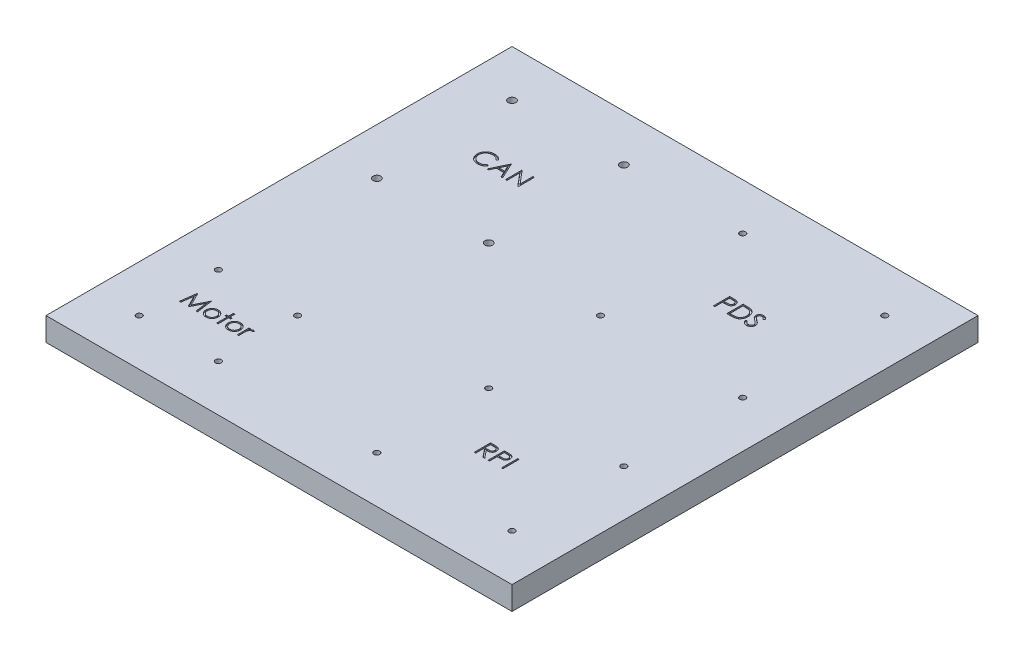
from build123d import *

# Parameters (mm, degrees)
SKETCH1_W           = 200
SKETCH1_H           = 200
BOSS_EXTRUDE2_DEPTH = 10
SKETCH1_4_R         = 1.25
SKETCH1_4_R_2       = 1.65
CUT_EXTRUDE1_DEPTH  = 284.019433962
SKETCH2_W           = 0.628205128
SKETCH2_H           = 7
CUT_EXTRUDE2_DEPTH  = 0.5


with BuildPart() as part:
    # Sketch1 → Boss-Extrude2 (new body)
    with BuildSketch(Plane(origin=(0, 0, 0), x_dir=(1, 0, 0), z_dir=(0, 1, 0))):
        with Locations((100, 100)):
            Rectangle(SKETCH1_W, SKETCH1_H)
    extrude(amount=BOSS_EXTRUDE2_DEPTH)

    # Sketch1<4> → Cut-Extrude1 (cut, through all)
    with BuildSketch(Plane(origin=(0, 0, 0), x_dir=(1, 0, 0), z_dir=(0, 1, 0))):
        with Locations((180, 180)):
            Circle(SKETCH1_4_R)
        with Locations((119, 180)):
            Circle(SKETCH1_4_R)
        with Locations((119, 119)):
            Circle(SKETCH1_4_R)
        with Locations((180, 119)):
            Circle(SKETCH1_4_R)
        with Locations((20, 180)):
            Circle(SKETCH1_4_R_2)
        with Locations((68, 180)):
            Circle(SKETCH1_4_R_2)
        with Locations((20, 122)):
            Circle(SKETCH1_4_R_2)
        with Locations((68, 122)):
            Circle(SKETCH1_4_R_2)
        with Locations((20, 20)):
            Circle(SKETCH1_4_R)
        with Locations((20, 54)):
            Circle(SKETCH1_4_R)
        with Locations((54, 54)):
            Circle(SKETCH1_4_R)
        with Locations((54, 20)):
            Circle(SKETCH1_4_R)
        with Locations((180, 68)):
            Circle(SKETCH1_4_R)
        with Locations((180, 20)):
            Circle(SKETCH1_4_R)
        with Locations((122, 68)):
            Circle(SKETCH1_4_R)
        with Locations((122, 20)):
            Circle(SKETCH1_4_R)
    extrude(amount=CUT_EXTRUDE1_DEPTH, mode=Mode.SUBTRACT)

    # Sketch2 → Cut-Extrude2 (cut)
    # profile 1 of 14: a face of its own
    with BuildSketch(Plane(origin=(0, 10, 0), x_dir=(1, 0, 0), z_dir=(0, 1, 0))):
        Polygon((23.329689197, 33.84313401), (24.253767723, 40.84313401), (24.343511313, 40.84313401), (27.233535351, 35.099544266), (30.115145928, 40.84313401), (30.204889518, 40.84313401), (31.137381505, 33.84313401), (30.509176377, 33.84313401), (29.836099454, 38.875786254), (27.310658749, 33.84313401), (27.167629902, 33.84313401), (24.630971249, 38.891210933), (23.962101056, 33.84313401), align=None)
    # profile 2 of 14: a face of its own
    with BuildSketch(Plane(origin=(0, 10, 0), x_dir=(1, 0, 0), z_dir=(0, 1, 0))):
        with BuildLine():
            add(Edge.make_bspline(
                [(34.864544967, 39.048262215), (34.960527512, 39.046218433), (35.148725827, 39.042211075), (35.424341599, 38.999381144), (35.687431871, 38.933886415), (35.939004255, 38.843343291), (36.175836846, 38.72197939), (36.401379334, 38.577160808), (36.615013352, 38.405595621), (36.743059411, 38.272879484), (36.808054582, 38.205513818)],
                knots=[0, 0, 0, 0, 1.054011418, 2.066658804, 3.057071809, 4.030435133, 4.997543892, 5.974964718, 6.972108034, 8, 8, 8, 8], degree=3))
            add(Edge.make_bspline(
                [(36.808054582, 38.205513818), (36.86401849, 38.141085846), (36.974863251, 38.013476762), (37.116994688, 37.806565536), (37.239437808, 37.592285335), (37.33756373, 37.367790681), (37.414933778, 37.135041339), (37.46986517, 36.893237317), (37.50253904, 36.642912622), (37.506944974, 36.472904946), (37.509176377, 36.386803882)],
                knots=[0, 0, 0, 0, 1.025258237, 2.030674902, 3.01204498, 3.988269485, 4.97094183, 5.956517959, 6.965070386, 8, 8, 8, 8], degree=3))
            add(Edge.make_bspline(
                [(37.509176377, 36.386803882), (37.507213702, 36.300203766), (37.503335366, 36.1290779), (37.466648133, 35.877039168), (37.409585961, 35.632649523), (37.327922285, 35.396932135), (37.223206066, 35.169166481), (37.095424691, 34.950347382), (36.943681457, 34.740043115), (36.771673463, 34.540039439), (36.581569711, 34.355707009), (36.375337414, 34.19505047), (36.157029347, 34.057407421), (35.92374264, 33.94653459), (35.677607667, 33.85911519), (35.41809353, 33.797715157), (35.14560339, 33.760591789), (34.959548947, 33.755824643), (34.864544967, 33.75339042)],
                knots=[0, 0, 0, 0, 0.998656419, 1.973391657, 2.932242238, 3.890759089, 4.846373663, 5.82037756, 6.809684879, 7.83454468, 8.860553229, 9.859544525, 10.845671541, 11.83227036, 12.833544569, 13.85385346, 14.904124723, 16, 16, 16, 16], degree=3))
            add(Edge.make_bspline(
                [(34.864544967, 33.75339042), (34.769075528, 33.755832813), (34.582093808, 33.760616362), (34.308641844, 33.797570927), (34.048662606, 33.859086892), (33.802205409, 33.946821878), (33.567915715, 34.057410965), (33.348342722, 34.194634344), (33.141942891, 34.355754655), (32.951798922, 34.540026529), (32.779801711, 34.740046442), (32.628055694, 34.950346519), (32.500275042, 35.169166705), (32.395558634, 35.396932075), (32.313895008, 35.632649539), (32.256832823, 35.877039164), (32.220145594, 36.129077901), (32.216267257, 36.300203767), (32.214304582, 36.386803882)],
                knots=[0, 0, 0, 0, 1.099876186, 2.154163076, 3.173186993, 4.173200201, 5.163417411, 6.152872554, 7.150605724, 8.17532212, 9.198891216, 10.186952605, 11.159729845, 12.11414092, 13.071450619, 14.029093627, 15.002601286, 16, 16, 16, 16], degree=3))
            add(Edge.make_bspline(
                [(32.214304582, 36.386803882), (32.216551203, 36.472436974), (32.220999126, 36.641975778), (32.253640144, 36.8918299), (32.308357257, 37.133224678), (32.38582005, 37.36507563), (32.484850431, 37.588586502), (32.605573007, 37.803396164), (32.749154272, 38.009371765), (32.859558175, 38.136815925), (32.915426377, 38.201307087)],
                knots=[0, 0, 0, 0, 1.031353054, 2.041901799, 3.029428768, 4.008703097, 4.981709435, 5.96992636, 6.972712378, 8, 8, 8, 8], degree=3))
            add(Edge.make_bspline(
                [(32.915426377, 38.201307087), (32.980323559, 38.269256965), (33.107955287, 38.402892358), (33.322652742, 38.573957406), (33.547640384, 38.721789554), (33.787090237, 38.840741985), (34.038455952, 38.93441902), (34.302894437, 38.99955005), (34.579445468, 39.04205676), (34.768564711, 39.046173116), (34.864544967, 39.048262215)],
                knots=[0, 0, 0, 0, 1.027980169, 2.021703884, 2.998553061, 3.971491411, 4.943284454, 5.930300938, 6.949603206, 8, 8, 8, 8], degree=3))
        make_face()
        with BuildLine():
            add(Edge.make_bspline(
                [(34.861740479, 38.420057087), (34.793865257, 38.418127904), (34.659866999, 38.414319338), (34.46262783, 38.385351529), (34.272747522, 38.339456521), (34.089865834, 38.274248408), (33.914599489, 38.190050611), (33.746780684, 38.08663389), (33.585915804, 37.965367977), (33.435151678, 37.826442634), (33.296787053, 37.674684645), (33.1758311, 37.512987927), (33.072980887, 37.343975235), (32.98730057, 37.167470812), (32.923486193, 36.981685984), (32.877140148, 36.788724722), (32.848199667, 36.588193889), (32.84442691, 36.451871852), (32.84250971, 36.382597151)],
                knots=[0, 0, 0, 0, 1.021534396, 2.016698045, 2.994645724, 3.958388632, 4.93408049, 5.916473867, 6.921342795, 7.962252576, 8.998418191, 10.008913653, 10.997312074, 11.973003931, 12.956656626, 13.948281152, 14.957379055, 16, 16, 16, 16], degree=3))
            add(Edge.make_bspline(
                [(32.84250971, 36.382597151), (32.845723357, 36.293093097), (32.852101846, 36.115444286), (32.903972319, 35.85382204), (32.990744879, 35.602658336), (33.107919438, 35.363425564), (33.254731876, 35.142081008), (33.427706009, 34.944738039), (33.62498541, 34.774366416), (33.84421841, 34.633004725), (34.080927046, 34.520685214), (34.331439688, 34.441087262), (34.592721076, 34.389343878), (34.771282539, 34.384200929), (34.861740479, 34.381595548)],
                knots=[0, 0, 0, 0, 1.016792936, 2.018143844, 3.017858371, 4.030088057, 5.03801393, 6.028138512, 7.003788237, 7.991172063, 8.984598303, 9.972568034, 10.972917682, 12, 12, 12, 12], degree=3))
            add(Edge.make_bspline(
                [(34.861740479, 34.381595548), (34.952193217, 34.384216109), (35.130744409, 34.389389023), (35.391662763, 34.440826662), (35.641490707, 34.521033984), (35.877953482, 34.632878403), (36.097086689, 34.774903233), (36.295784931, 34.943775987), (36.467282153, 35.14260369), (36.613949363, 35.363718747), (36.733042849, 35.602287452), (36.819409252, 35.853868396), (36.871404424, 36.11543248), (36.877766081, 36.293089141), (36.880971249, 36.382597151)],
                knots=[0, 0, 0, 0, 1.02726834, 2.027799167, 3.010890988, 4.004497153, 4.992059811, 5.971914811, 6.958719428, 7.966827853, 8.981595046, 9.981490638, 10.983022906, 12, 12, 12, 12], degree=3))
            add(Edge.make_bspline(
                [(36.880971249, 36.382597151), (36.879054709, 36.451872266), (36.87528325, 36.588195118), (36.846333322, 36.788720025), (36.800022242, 36.981703218), (36.736079008, 37.167407225), (36.65077098, 37.344432233), (36.545937394, 37.512491688), (36.425475343, 37.67524478), (36.285441101, 37.825952061), (36.134834346, 37.965422134), (35.973904269, 38.086680913), (35.806334312, 38.189596104), (35.631577147, 38.274968585), (35.448672011, 38.338863266), (35.259057753, 38.385616529), (35.062660133, 38.414196922), (34.929142047, 38.418091205), (34.861740479, 38.420057087)],
                knots=[0, 0, 0, 0, 1.042956736, 2.052379634, 3.044323526, 4.02829302, 5.004299113, 5.996692471, 7.007513377, 8.048758398, 9.090003419, 10.095195979, 11.07790575, 12.047570684, 13.018257071, 13.989683339, 14.985167495, 16, 16, 16, 16], degree=3))
        make_face(mode=Mode.SUBTRACT)
    # profile 3 of 14: a face of its own
    with BuildSketch(Plane(origin=(0, 10, 0), x_dir=(1, 0, 0), z_dir=(0, 1, 0))):
        Polygon((39.393791761, 41.022621189), (40.02199689, 41.022621189), (40.02199689, 38.958518625), (40.919432787, 38.958518625), (40.919432787, 38.330313497), (40.02199689, 38.330313497), (40.02199689, 33.84313401), (39.393791761, 33.84313401), (39.393791761, 38.330313497), (38.496355864, 38.330313497), (38.496355864, 38.958518625), (39.393791761, 38.958518625), align=None)
    # profile 4 of 14: a face of its own
    with BuildSketch(Plane(origin=(0, 10, 0), x_dir=(1, 0, 0), z_dir=(0, 1, 0))):
        with BuildLine():
            add(Edge.make_bspline(
                [(44.467109069, 39.048262215), (44.563091615, 39.046218433), (44.75128993, 39.042211075), (45.026905702, 38.999381144), (45.289995974, 38.933886415), (45.541568358, 38.843343291), (45.778400949, 38.72197939), (46.003943437, 38.577160808), (46.217577455, 38.405595621), (46.345623513, 38.272879484), (46.410618685, 38.205513818)],
                knots=[0, 0, 0, 0, 1.054011418, 2.066658804, 3.057071809, 4.030435133, 4.997543892, 5.974964718, 6.972108034, 8, 8, 8, 8], degree=3))
            add(Edge.make_bspline(
                [(46.410618685, 38.205513818), (46.466582593, 38.141085846), (46.577427353, 38.013476762), (46.719558791, 37.806565536), (46.842001911, 37.592285335), (46.940127833, 37.367790681), (47.01749788, 37.135041339), (47.072429273, 36.893237317), (47.105103143, 36.642912622), (47.109509077, 36.472904946), (47.111740479, 36.386803882)],
                knots=[0, 0, 0, 0, 1.025258237, 2.030674902, 3.01204498, 3.988269485, 4.97094183, 5.956517959, 6.965070386, 8, 8, 8, 8], degree=3))
            add(Edge.make_bspline(
                [(47.111740479, 36.386803882), (47.109777805, 36.300203766), (47.105899468, 36.1290779), (47.069212235, 35.877039168), (47.012150064, 35.632649523), (46.930486387, 35.396932135), (46.825770169, 35.169166481), (46.697988794, 34.950347382), (46.546245559, 34.740043115), (46.374237566, 34.540039439), (46.184133814, 34.355707009), (45.977901517, 34.19505047), (45.759593449, 34.057407421), (45.526306743, 33.94653459), (45.280171769, 33.85911519), (45.020657633, 33.797715157), (44.748167492, 33.760591789), (44.56211305, 33.755824643), (44.467109069, 33.75339042)],
                knots=[0, 0, 0, 0, 0.998656419, 1.973391657, 2.932242238, 3.890759089, 4.846373663, 5.82037756, 6.809684879, 7.83454468, 8.860553229, 9.859544525, 10.845671541, 11.83227036, 12.833544569, 13.85385346, 14.904124723, 16, 16, 16, 16], degree=3))
            add(Edge.make_bspline(
                [(44.467109069, 33.75339042), (44.37163963, 33.755832813), (44.184657911, 33.760616362), (43.911205947, 33.797570927), (43.651226709, 33.859086892), (43.404769512, 33.946821878), (43.170479818, 34.057410965), (42.950906824, 34.194634344), (42.744506993, 34.355754655), (42.554363024, 34.540026529), (42.382365814, 34.740046442), (42.230619797, 34.950346519), (42.102839145, 35.169166705), (41.998122737, 35.396932075), (41.916459111, 35.632649539), (41.859396926, 35.877039164), (41.822709697, 36.129077901), (41.818831359, 36.300203767), (41.816868685, 36.386803882)],
                knots=[0, 0, 0, 0, 1.099876186, 2.154163076, 3.173186993, 4.173200201, 5.163417411, 6.152872554, 7.150605724, 8.17532212, 9.198891216, 10.186952605, 11.159729845, 12.11414092, 13.071450619, 14.029093627, 15.002601286, 16, 16, 16, 16], degree=3))
            add(Edge.make_bspline(
                [(41.816868685, 36.386803882), (41.819115305, 36.472436974), (41.823563228, 36.641975778), (41.856204246, 36.8918299), (41.910921359, 37.133224678), (41.988384152, 37.36507563), (42.087414534, 37.588586502), (42.20813711, 37.803396164), (42.351718375, 38.009371765), (42.462122278, 38.136815925), (42.517990479, 38.201307087)],
                knots=[0, 0, 0, 0, 1.031353054, 2.041901799, 3.029428768, 4.008703097, 4.981709435, 5.96992636, 6.972712378, 8, 8, 8, 8], degree=3))
            add(Edge.make_bspline(
                [(42.517990479, 38.201307087), (42.582887661, 38.269256965), (42.710519389, 38.402892358), (42.925216845, 38.573957406), (43.150204487, 38.721789554), (43.389654339, 38.840741985), (43.641020055, 38.93441902), (43.90545854, 38.99955005), (44.182009571, 39.04205676), (44.371128813, 39.046173116), (44.467109069, 39.048262215)],
                knots=[0, 0, 0, 0, 1.027980169, 2.021703884, 2.998553061, 3.971491411, 4.943284454, 5.930300938, 6.949603206, 8, 8, 8, 8], degree=3))
        make_face()
        with BuildLine():
            add(Edge.make_bspline(
                [(44.464304582, 38.420057087), (44.396429359, 38.418127904), (44.262431102, 38.414319338), (44.065191933, 38.385351529), (43.875311625, 38.339456521), (43.692429936, 38.274248408), (43.517163592, 38.190050611), (43.349344787, 38.08663389), (43.188479907, 37.965367977), (43.03771578, 37.826442634), (42.899351156, 37.674684645), (42.778395203, 37.512987927), (42.67554499, 37.343975235), (42.589864672, 37.167470812), (42.526050296, 36.981685984), (42.479704251, 36.788724722), (42.45076377, 36.588193889), (42.446991013, 36.451871852), (42.445073813, 36.382597151)],
                knots=[0, 0, 0, 0, 1.021534396, 2.016698045, 2.994645724, 3.958388632, 4.93408049, 5.916473867, 6.921342795, 7.962252576, 8.998418191, 10.008913653, 10.997312074, 11.973003931, 12.956656626, 13.948281152, 14.957379055, 16, 16, 16, 16], degree=3))
            add(Edge.make_bspline(
                [(42.445073813, 36.382597151), (42.44828746, 36.293093097), (42.454665949, 36.115444286), (42.506536422, 35.85382204), (42.593308982, 35.602658336), (42.710483541, 35.363425564), (42.857295978, 35.142081008), (43.030270112, 34.944738039), (43.227549512, 34.774366416), (43.446782513, 34.633004725), (43.683491149, 34.520685214), (43.934003791, 34.441087262), (44.195285179, 34.389343878), (44.373846641, 34.384200929), (44.464304582, 34.381595548)],
                knots=[0, 0, 0, 0, 1.016792936, 2.018143844, 3.017858371, 4.030088057, 5.03801393, 6.028138512, 7.003788237, 7.991172063, 8.984598303, 9.972568034, 10.972917682, 12, 12, 12, 12], degree=3))
            add(Edge.make_bspline(
                [(44.464304582, 34.381595548), (44.55475732, 34.384216109), (44.733308512, 34.389389023), (44.994226865, 34.440826662), (45.244054809, 34.521033984), (45.480517584, 34.632878403), (45.699650791, 34.774903233), (45.898349034, 34.943775987), (46.069846256, 35.14260369), (46.216513466, 35.363718747), (46.335606951, 35.602287452), (46.421973355, 35.853868396), (46.473968527, 36.11543248), (46.480330184, 36.293089141), (46.483535351, 36.382597151)],
                knots=[0, 0, 0, 0, 1.02726834, 2.027799167, 3.010890988, 4.004497153, 4.992059811, 5.971914811, 6.958719428, 7.966827853, 8.981595046, 9.981490638, 10.983022906, 12, 12, 12, 12], degree=3))
            add(Edge.make_bspline(
                [(46.483535351, 36.382597151), (46.481618811, 36.451872266), (46.477847353, 36.588195118), (46.448897424, 36.788720025), (46.402586345, 36.981703218), (46.33864311, 37.167407225), (46.253335083, 37.344432233), (46.148501496, 37.512491688), (46.028039446, 37.67524478), (45.888005204, 37.825952061), (45.737398448, 37.965422134), (45.576468372, 38.086680913), (45.408898415, 38.189596104), (45.234141249, 38.274968585), (45.051236114, 38.338863266), (44.861621856, 38.385616529), (44.665224236, 38.414196922), (44.531706149, 38.418091205), (44.464304582, 38.420057087)],
                knots=[0, 0, 0, 0, 1.042956736, 2.052379634, 3.044323526, 4.02829302, 5.004299113, 5.996692471, 7.007513377, 8.048758398, 9.090003419, 10.095195979, 11.07790575, 12.047570684, 13.018257071, 13.989683339, 14.985167495, 16, 16, 16, 16], degree=3))
        make_face(mode=Mode.SUBTRACT)
    # profile 5 of 14: a face of its own
    with BuildSketch(Plane(origin=(0, 10, 0), x_dir=(1, 0, 0), z_dir=(0, 1, 0))):
        with BuildLine():
            Line((48.188663556, 38.958518625), (48.816868685, 38.958518625))
            Line((48.816868685, 38.958518625), (48.816868685, 38.205513818))
            add(Edge.make_bspline(
                [(48.816868685, 38.205513818), (48.863246202, 38.275625474), (48.951942844, 38.409713473), (49.099368703, 38.587052075), (49.250375365, 38.733882168), (49.40568574, 38.850889206), (49.56644194, 38.938515443), (49.729115843, 39.002701513), (49.896266783, 39.040656144), (50.008590631, 39.045723462), (50.064865479, 39.048262215)],
                knots=[0, 0, 0, 0, 1.2804753, 2.448899062, 3.506932113, 4.484331642, 5.4025378, 6.288909075, 7.142734305, 8, 8, 8, 8], degree=3))
            add(Edge.make_bspline(
                [(50.064865479, 39.048262215), (50.108518132, 39.045881162), (50.198336303, 39.04098199), (50.334301482, 39.006560341), (50.474388386, 38.951604296), (50.564673161, 38.899923851), (50.611740479, 38.872981766)],
                knots=[0, 0, 0, 0, 0.901110191, 1.854092781, 2.881294221, 4, 4, 4, 4], degree=3))
            Line((50.611740479, 38.872981766), (50.266788556, 38.328911254))
            add(Edge.make_bspline(
                [(50.266788556, 38.328911254), (50.236570514, 38.342391786), (50.179210885, 38.367980417), (50.095301752, 38.398264437), (50.017939079, 38.416096269), (49.968651962, 38.418797704), (49.945674774, 38.420057087)],
                knots=[0, 0, 0, 0, 1.180555205, 2.24091978, 3.179933427, 4, 4, 4, 4], degree=3))
            add(Edge.make_bspline(
                [(49.945674774, 38.420057087), (49.895263307, 38.416697012), (49.792438527, 38.409843434), (49.641469528, 38.355965818), (49.494975117, 38.268915338), (49.378631793, 38.172373114), (49.288547287, 38.079277519), (49.224266836, 37.997980714), (49.165301342, 37.906823451), (49.108960901, 37.807364084), (49.057628313, 37.697904391), (49.009718974, 37.579537965), (48.966401249, 37.452127707), (48.94170076, 37.363362667), (48.929048172, 37.317893625)],
                knots=[0, 0, 0, 0, 1.125678352, 2.296057538, 3.5422874, 4.923748041, 5.663163013, 6.437101912, 7.23742474, 8.08941207, 8.991984279, 9.93940061, 10.944477711, 12, 12, 12, 12], degree=3))
            add(Edge.make_bspline(
                [(48.929048172, 37.317893625), (48.919583385, 37.277339278), (48.898619602, 37.187514481), (48.878236526, 37.036817432), (48.85809749, 36.858770114), (48.843904253, 36.652876928), (48.830748169, 36.41965204), (48.823328005, 36.158740149), (48.817121723, 35.869873447), (48.81695559, 35.66792474), (48.816868685, 35.562284651)],
                knots=[0, 0, 0, 0, 0.566838948, 1.255505196, 2.06880316, 3.007127437, 4.065329342, 5.249902469, 6.561414163, 8, 8, 8, 8], degree=3))
            Line((48.816868685, 35.562284651), (48.816868685, 33.84313401))
            Line((48.816868685, 33.84313401), (48.188663556, 33.84313401))
            Line((48.188663556, 33.84313401), (48.188663556, 38.958518625))
        make_face()
    # profile 6 of 14: a face of its own
    with BuildSketch(Plane(origin=(0, 10, 0), x_dir=(1, 0, 0), z_dir=(0, 1, 0))):
        with BuildLine():
            Line((142.709193492, 48.1080235), (144.110034838, 48.1080235))
            add(Edge.make_bspline(
                [(144.110034838, 48.1080235), (144.203517095, 48.107712328), (144.383013384, 48.107114843), (144.640159924, 48.103783317), (144.873814118, 48.094234606), (145.083853797, 48.086017439), (145.270275107, 48.071033556), (145.433649688, 48.056712262), (145.573225083, 48.03796494), (145.657716786, 48.020554094), (145.695972338, 48.012670935)],
                knots=[0, 0, 0, 0, 1.410062039, 2.707475311, 3.878576406, 4.937260626, 5.877586885, 6.699081471, 7.410979367, 8, 8, 8, 8], degree=3))
            add(Edge.make_bspline(
                [(145.695972338, 48.012670935), (145.747185586, 48.000017405), (145.848519565, 47.974980277), (145.994419697, 47.922061076), (146.133448345, 47.860821827), (146.265027994, 47.788894386), (146.388499576, 47.705744827), (146.505136198, 47.612808582), (146.615467124, 47.51059417), (146.715030385, 47.396524487), (146.808908488, 47.276851468), (146.888085741, 47.147443954), (146.956338701, 47.012120899), (147.010679735, 46.869506064), (147.054435681, 46.72098252), (147.08528816, 46.565204926), (147.103790535, 46.402882976), (147.105674247, 46.292167159), (147.106629389, 46.236028307)],
                knots=[0, 0, 0, 0, 1.027469482, 2.033020251, 3.019912614, 3.986113645, 4.951240523, 5.91722682, 6.890402269, 7.87763091, 8.8651537, 9.85103654, 10.82876324, 11.815024772, 12.821070561, 13.842952187, 14.906261191, 16, 16, 16, 16], degree=3))
            add(Edge.make_bspline(
                [(147.106629389, 46.236028307), (147.103691393, 46.142758098), (147.097958601, 45.960763762), (147.044508394, 45.696641999), (146.956955354, 45.45026337), (146.836308776, 45.221938094), (146.682669825, 45.016116804), (146.498020243, 44.835335893), (146.28225702, 44.684056068), (146.081398388, 44.579150458), (145.903969989, 44.511964641), (145.757903363, 44.464691923), (145.598569408, 44.428167993), (145.427494739, 44.395447729), (145.243967428, 44.370744341), (145.048427349, 44.352651152), (144.840735046, 44.341343054), (144.698056907, 44.339659044), (144.624658235, 44.33879273)],
                knots=[0, 0, 0, 0, 1.260483769, 2.459530307, 3.627416485, 4.787058657, 5.939039949, 7.08810263, 8.267026773, 9.491475466, 10.141966685, 10.831826277, 11.566392101, 12.351337768, 13.187381173, 14.07005841, 15.007169909, 16, 16, 16, 16], degree=3))
            Line((144.624658235, 44.33879273), (147.196372979, 41.1080235))
            Line((147.196372979, 41.1080235), (146.41953003, 41.1080235))
            Line((146.41953003, 41.1080235), (143.847815286, 44.33879273))
            Line((143.847815286, 44.33879273), (143.33739862, 44.33879273))
            Line((143.33739862, 44.33879273), (143.33739862, 41.1080235))
            Line((143.33739862, 41.1080235), (142.709193492, 41.1080235))
            Line((142.709193492, 41.1080235), (142.709193492, 48.1080235))
        make_face()
        with BuildLine():
            Line((143.33739862, 47.390074782), (143.33739862, 45.056741448))
            Line((143.33739862, 45.056741448), (144.619049261, 45.046925743))
            add(Edge.make_bspline(
                [(144.619049261, 45.046925743), (144.678889339, 45.04689927), (144.794876453, 45.046847957), (144.962677783, 45.05483551), (145.118918006, 45.063922146), (145.26299951, 45.077820837), (145.394986661, 45.095732981), (145.514813487, 45.118138949), (145.622675591, 45.144243074), (145.748472668, 45.184646326), (145.888945731, 45.248658362), (146.04160865, 45.34178936), (146.171613326, 45.458927598), (146.281449051, 45.59287451), (146.369707913, 45.740147008), (146.431932022, 45.898979746), (146.471416907, 46.065362942), (146.476073998, 46.179719158), (146.478424261, 46.237430551)],
                knots=[0, 0, 0, 0, 1.146690395, 2.22261258, 3.21895312, 4.145990853, 4.996080663, 5.770904154, 6.481378293, 7.121626537, 8.300444488, 9.431385265, 10.535395872, 11.636531494, 12.74115979, 13.810798291, 14.895190096, 16, 16, 16, 16], degree=3))
            add(Edge.make_bspline(
                [(146.478424261, 46.237430551), (146.476020019, 46.293723698), (146.471255688, 46.405276176), (146.432358151, 46.568587996), (146.366579388, 46.722721896), (146.277934912, 46.867050866), (146.169936602, 46.998062338), (146.043300977, 47.110156644), (145.901490587, 47.202655574), (145.76894819, 47.261764335), (145.650479765, 47.298004041), (145.547620445, 47.323506369), (145.431397489, 47.343995307), (145.301246572, 47.360411428), (145.157723311, 47.374521317), (145.000102009, 47.384024874), (144.829428448, 47.389652602), (144.711134586, 47.38993078), (144.64989862, 47.390074782)],
                knots=[0, 0, 0, 0, 1.101028733, 2.181837193, 3.264309656, 4.369019818, 5.486613113, 6.575447106, 7.666700264, 8.788928104, 9.402425223, 10.0903467, 10.862060571, 11.710948788, 12.657782767, 13.684531032, 14.801375019, 16, 16, 16, 16], degree=3))
            Line((144.64989862, 47.390074782), (143.33739862, 47.390074782))
        make_face(mode=Mode.SUBTRACT)
    # profile 7 of 14: a face of its own
    with BuildSketch(Plane(origin=(0, 10, 0), x_dir=(1, 0, 0), z_dir=(0, 1, 0))):
        with BuildLine():
            Line((148.632270415, 48.1080235), (150.005066889, 48.1080235))
            add(Edge.make_bspline(
                [(150.005066889, 48.1080235), (150.099488701, 48.107919707), (150.280405087, 48.107720836), (150.539835198, 48.101691344), (150.775454662, 48.09363796), (150.986755423, 48.082474174), (151.17438762, 48.069280993), (151.337502219, 48.050776915), (151.477381331, 48.031456323), (151.56119423, 48.01181351), (151.599417851, 48.00285523)],
                knots=[0, 0, 0, 0, 1.415646017, 2.712440637, 3.8905458, 4.950247383, 5.884950622, 6.709939814, 7.411656543, 8, 8, 8, 8], degree=3))
            add(Edge.make_bspline(
                [(151.599417851, 48.00285523), (151.647804918, 47.989611331), (151.743438873, 47.963435607), (151.881240959, 47.91100816), (152.01234865, 47.84884383), (152.137211767, 47.77799595), (152.254295933, 47.695424822), (152.365348015, 47.604477586), (152.469387975, 47.503054449), (152.565830759, 47.39229297), (152.654400354, 47.27405255), (152.73065972, 47.14656809), (152.794514174, 47.011985483), (152.849280717, 46.870398341), (152.888697626, 46.720617694), (152.918391425, 46.563684269), (152.93723868, 46.399614889), (152.939043804, 46.287495154), (152.939962722, 46.230419333)],
                knots=[0, 0, 0, 0, 0.999701418, 1.975846123, 2.934577507, 3.890451536, 4.834027766, 5.787354733, 6.749476667, 7.726910423, 8.712836071, 9.690891519, 10.682875813, 11.679750201, 12.712814741, 13.765529915, 14.8625177, 16, 16, 16, 16], degree=3))
            add(Edge.make_bspline(
                [(152.939962722, 46.230419333), (152.939119873, 46.172863779), (152.937470781, 46.060252451), (152.91767821, 45.895506875), (152.891017827, 45.738070095), (152.850023722, 45.588291194), (152.796332376, 45.447059653), (152.733348271, 45.312217189), (152.65738121, 45.186057845), (152.57009155, 45.06812361), (152.472988362, 44.958303785), (152.366482485, 44.857394196), (152.2510039, 44.76598552), (152.126919604, 44.683872832), (151.993019906, 44.612960273), (151.851335599, 44.549445663), (151.700635167, 44.496103542), (151.596350139, 44.468043419), (151.543328107, 44.453776705)],
                knots=[0, 0, 0, 0, 1.121902311, 2.195077645, 3.232258892, 4.234102512, 5.217864754, 6.176164875, 7.132989551, 8.084763148, 9.034132444, 9.988522005, 10.94243251, 11.903244335, 12.886203696, 13.894208494, 14.929344452, 16, 16, 16, 16], degree=3))
            add(Edge.make_bspline(
                [(151.543328107, 44.453776705), (151.499473439, 44.444450743), (151.403363384, 44.424012354), (151.24507794, 44.401195441), (151.060787168, 44.381720239), (150.850742608, 44.367117964), (150.615132798, 44.354617227), (150.353830284, 44.344681039), (150.066322129, 44.339221332), (149.865779641, 44.338939746), (149.761076504, 44.33879273)],
                knots=[0, 0, 0, 0, 0.601384939, 1.31797006, 2.144135048, 3.087295005, 4.142315834, 5.309527816, 6.595305764, 8, 8, 8, 8], degree=3))
            Line((149.761076504, 44.33879273), (149.260475543, 44.33879273))
            Line((149.260475543, 44.33879273), (149.260475543, 41.1080235))
            Line((149.260475543, 41.1080235), (148.632270415, 41.1080235))
            Line((148.632270415, 41.1080235), (148.632270415, 48.1080235))
        make_face()
        with BuildLine():
            Line((149.260475543, 47.390074782), (149.260475543, 45.056741448))
            Line((149.260475543, 45.056741448), (150.48603644, 45.041316769))
            add(Edge.make_bspline(
                [(150.48603644, 45.041316769), (150.545876292, 45.041285842), (150.661395892, 45.041226137), (150.828268338, 45.049196584), (150.983086913, 45.05839765), (151.125376064, 45.071869497), (151.255199933, 45.090912011), (151.37277499, 45.110135487), (151.477189556, 45.137946213), (151.59938796, 45.175392351), (151.735554655, 45.239257582), (151.883689752, 45.331957362), (152.009230924, 45.450118779), (152.117867518, 45.582974441), (152.204079274, 45.7307727), (152.267191258, 45.888910574), (152.304273573, 46.055766273), (152.30924596, 46.16994255), (152.311757594, 46.227614846)],
                knots=[0, 0, 0, 0, 1.160613943, 2.240541288, 3.23993089, 4.169200891, 5.011653406, 5.7853311, 6.478053781, 7.106038997, 8.262395093, 9.384106736, 10.481365981, 11.59014053, 12.70357646, 13.786202915, 14.881775077, 16, 16, 16, 16], degree=3))
            add(Edge.make_bspline(
                [(152.311757594, 46.227614846), (152.309232301, 46.283891873), (152.304212331, 46.395763637), (152.266900605, 46.559721158), (152.204201977, 46.716192567), (152.117288788, 46.862138738), (152.011806528, 46.994516346), (151.889207842, 47.1095106), (151.749781319, 47.201954005), (151.620084857, 47.261620568), (151.504882485, 47.298051119), (151.404818565, 47.3235408), (151.291837216, 47.343892013), (151.165901657, 47.360371018), (151.02798799, 47.374477941), (150.87691136, 47.384049895), (150.713244073, 47.389652808), (150.599622932, 47.389930718), (150.54072394, 47.390074782)],
                knots=[0, 0, 0, 0, 1.120700087, 2.227813068, 3.331159281, 4.466773991, 5.599788987, 6.693661531, 7.80175334, 8.91857717, 9.525282508, 10.207424825, 10.974604443, 11.810962634, 12.737642355, 13.736264703, 14.826523623, 16, 16, 16, 16], degree=3))
            Line((150.54072394, 47.390074782), (149.260475543, 47.390074782))
        make_face(mode=Mode.SUBTRACT)
    # profile 8 of 14: a face of its own
    with BuildSketch(Plane(origin=(0, 10, 0), x_dir=(1, 0, 0), z_dir=(0, 1, 0))):
        with Locations((154.689962722, 44.6080235)):
            Rectangle(SKETCH2_W, SKETCH2_H)
    # profile 9 of 14: a face of its own
    with BuildSketch(Plane(origin=(0, 10, 0), x_dir=(1, 0, 0), z_dir=(0, 1, 0))):
        with BuildLine():
            Line((39.269956909, 154.869478014), (38.720277422, 154.448804937))
            add(Edge.make_bspline(
                [(38.720277422, 154.448804937), (38.681065645, 154.495536877), (38.603170751, 154.588370708), (38.477852346, 154.718729797), (38.347249061, 154.84086032), (38.211410818, 154.955344079), (38.067892579, 155.058177611), (37.920170982, 155.154719816), (37.765774891, 155.241255292), (37.552271422, 155.346181265), (37.272975726, 155.455673575), (36.921386047, 155.547480037), (36.55436385, 155.605922389), (36.303968651, 155.612252072), (36.17660755, 155.615471604)],
                knots=[0, 0, 0, 0, 0.757959112, 1.505699292, 2.245454638, 2.979532153, 3.711538275, 4.438200793, 5.171680507, 5.909471876, 7.393775596, 8.890124382, 10.418191784, 12, 12, 12, 12], degree=3))
            add(Edge.make_bspline(
                [(36.17660755, 155.615471604), (36.106440951, 155.614663679), (35.966758966, 155.613055327), (35.759462019, 155.591837076), (35.556035917, 155.562014656), (35.356612984, 155.51776401), (35.161447067, 155.461818772), (34.969262263, 155.394967944), (34.782841064, 155.312258264), (34.599604587, 155.220841744), (34.424046165, 155.117586855), (34.25793607, 155.004960151), (34.101880134, 154.884221958), (33.95575491, 154.754919745), (33.819411013, 154.617635824), (33.693836391, 154.470907141), (33.579465571, 154.315202794), (33.474031521, 154.152575979), (33.379606054, 153.983500396), (33.300546295, 153.807350255), (33.230536051, 153.627142049), (33.175137565, 153.440839727), (33.131288532, 153.249754196), (33.101033205, 153.05337262), (33.080056263, 152.85210526), (33.078455909, 152.715686635), (33.077649217, 152.646921924)],
                knots=[0, 0, 0, 0, 1.054917814, 2.100044995, 3.131103042, 4.146048494, 5.169673617, 6.183595914, 7.203665975, 8.234915748, 9.262203917, 10.264457458, 11.251630812, 12.227803204, 13.197192746, 14.159520551, 15.12972552, 16.100847026, 17.073214652, 18.039054194, 19.002613845, 19.979014051, 20.95965708, 21.949030935, 22.966165397, 24, 24, 24, 24], degree=3))
            add(Edge.make_bspline(
                [(33.077649217, 152.646921924), (33.080172855, 152.543459284), (33.085127683, 152.340324115), (33.129224351, 152.042782894), (33.196234534, 151.757741546), (33.296665688, 151.486981861), (33.420503789, 151.227165145), (33.576985012, 150.982687438), (33.758218087, 150.749854309), (33.966766926, 150.534168414), (34.195578558, 150.337140963), (34.441074381, 150.1636398), (34.702642956, 150.019010035), (34.977396217, 149.898658142), (35.267448445, 149.806144687), (35.572278049, 149.74101644), (35.89122204, 149.698532079), (36.10916084, 149.694464703), (36.220077101, 149.692394681)],
                knots=[0, 0, 0, 0, 1.029171465, 2.020641659, 2.987623507, 3.938342917, 4.889210282, 5.84687017, 6.821220943, 7.821438502, 8.827599549, 9.822697543, 10.807740252, 11.797342354, 12.80366471, 13.83203677, 14.896651826, 16, 16, 16, 16], degree=3))
            add(Edge.make_bspline(
                [(36.220077101, 149.692394681), (36.342282479, 149.69577224), (36.582811897, 149.702420085), (36.93554795, 149.758738583), (37.273219481, 149.850054419), (37.595844654, 149.977850264), (37.902513947, 150.14398084), (38.193707267, 150.345376594), (38.469670408, 150.58395326), (38.635612973, 150.766119516), (38.720277422, 150.859061347)],
                knots=[0, 0, 0, 0, 1.028121516, 2.023589091, 2.998037872, 3.967518031, 4.937445131, 5.927275754, 6.942489185, 8, 8, 8, 8], degree=3))
            Line((38.720277422, 150.859061347), (39.269956909, 150.442595001))
            add(Edge.make_bspline(
                [(39.269956909, 150.442595001), (39.225720689, 150.385518097), (39.137460139, 150.271637685), (38.994544105, 150.111094265), (38.84398951, 149.960086194), (38.68467809, 149.819830952), (38.518442507, 149.687522021), (38.342297882, 149.566918358), (38.158559817, 149.456336589), (37.967850859, 149.35508274), (37.770373634, 149.265248246), (37.566364764, 149.188340711), (37.356703613, 149.122090932), (37.141380596, 149.067587058), (36.919949082, 149.025044891), (36.693208134, 148.996605541), (36.460668384, 148.977121712), (36.303785541, 148.97534588), (36.224283832, 148.974445963)],
                knots=[0, 0, 0, 0, 0.986787822, 1.968848986, 2.935600012, 3.899624008, 4.868462664, 5.837806735, 6.815139263, 7.798259679, 8.787526145, 9.778297419, 10.776456485, 11.791383307, 12.812564526, 13.85620153, 14.913611965, 16, 16, 16, 16], degree=3))
            add(Edge.make_bspline(
                [(36.224283832, 148.974445963), (36.148996498, 148.974969948), (36.000125118, 148.976006063), (35.780327615, 148.992790398), (35.566348453, 149.015689872), (35.358799201, 149.050170134), (35.156547251, 149.090858814), (34.961426082, 149.145401328), (34.771515661, 149.206499661), (34.58757898, 149.278309634), (34.40945958, 149.359341999), (34.237731958, 149.450925117), (34.072475093, 149.552288846), (33.912064251, 149.661198867), (33.758869084, 149.781153471), (33.611562033, 149.91048674), (33.469317081, 150.048762762), (33.381311711, 150.148472468), (33.337064281, 150.198604616)],
                knots=[0, 0, 0, 0, 1.114604814, 2.203992996, 3.262667896, 4.300477797, 5.318619304, 6.316056647, 7.298880507, 8.271930387, 9.238335007, 10.195173496, 11.151986948, 12.108099108, 13.064862484, 14.031167946, 15.010108607, 16, 16, 16, 16], degree=3))
            add(Edge.make_bspline(
                [(33.337064281, 150.198604616), (33.266192994, 150.285686994), (33.12530604, 150.458800415), (32.945054673, 150.739372378), (32.790759563, 151.032308795), (32.666007721, 151.339148653), (32.568482255, 151.659203427), (32.500919865, 151.992634456), (32.457016656, 152.339130341), (32.451996078, 152.574803918), (32.449444088, 152.694598206)],
                knots=[0, 0, 0, 0, 0.994628077, 1.977248131, 2.950237994, 3.925870899, 4.908910175, 5.911660606, 6.938484602, 8, 8, 8, 8], degree=3))
            add(Edge.make_bspline(
                [(32.449444088, 152.694598206), (32.452554476, 152.820509113), (32.458673968, 153.068230962), (32.510665559, 153.431778869), (32.594303151, 153.780081667), (32.713096929, 154.112489156), (32.863707631, 154.430749716), (33.049760859, 154.732432126), (33.269095143, 155.019465725), (33.519990279, 155.287495228), (33.795124949, 155.532573933), (34.089762577, 155.748186341), (34.403326471, 155.927621373), (34.732362174, 156.077613698), (35.079333537, 156.192902624), (35.443500276, 156.273608997), (35.824178105, 156.32384323), (36.083902957, 156.330193646), (36.215870371, 156.333420322)],
                knots=[0, 0, 0, 0, 1.032925535, 2.032216505, 3.007276963, 3.968222605, 4.92396291, 5.891752235, 6.871517503, 7.883894988, 8.900124299, 9.891468569, 10.874487609, 11.85992873, 12.854644235, 13.869047385, 14.917252991, 16, 16, 16, 16], degree=3))
            add(Edge.make_bspline(
                [(36.215870371, 156.333420322), (36.296299314, 156.332456045), (36.455500309, 156.330547357), (36.691005614, 156.311935073), (36.920290268, 156.280907861), (37.143512232, 156.238675721), (37.361757464, 156.186261078), (37.573357946, 156.117980481), (37.77955532, 156.039907419), (37.979049136, 155.949990487), (38.170882236, 155.849057004), (38.354994873, 155.738225757), (38.529924591, 155.617634146), (38.696902288, 155.488307795), (38.85313471, 155.347510677), (39.003057667, 155.199115485), (39.141579823, 155.038847836), (39.227086213, 154.926037968), (39.269956909, 154.869478014)],
                knots=[0, 0, 0, 0, 1.096760587, 2.17092713, 3.219439832, 4.250915756, 5.268269357, 6.278326846, 7.281116186, 8.274029601, 9.260640565, 10.235837813, 11.203064059, 12.156899882, 13.114053108, 14.069676657, 15.032185724, 16, 16, 16, 16], degree=3))
        make_face()
    # profile 10 of 14: a face of its own
    with BuildSketch(Plane(origin=(0, 10, 0), x_dir=(1, 0, 0), z_dir=(0, 1, 0))):
        Polygon((43.577649217, 156.153933142), (46.808418447, 149.153933142), (46.125525819, 149.153933142), (45.09067005, 151.397522886), (41.917392806, 151.397522886), (40.854492165, 149.153933142), (40.167392806, 149.153933142), (43.487905627, 156.153933142), align=None)
        Polygon((43.525766204, 154.788147886), (42.259540242, 152.115471604), (44.759740563, 152.115471604), align=None, mode=Mode.SUBTRACT)
    # profile 11 of 14: a face of its own
    with BuildSketch(Plane(origin=(0, 10, 0), x_dir=(1, 0, 0), z_dir=(0, 1, 0))):
        Polygon((48.064828704, 149.153933142), (48.064828704, 156.153933142), (48.196639601, 156.153933142), (52.82123896, 150.644518078), (52.82123896, 156.153933142), (53.449444088, 156.153933142), (53.449444088, 149.153933142), (53.306415242, 149.153933142), (48.693033832, 154.650728014), (48.693033832, 149.153933142), align=None)
    # profile 12 of 14: a face of its own
    with BuildSketch(Plane(origin=(0, 10, 0), x_dir=(1, 0, 0), z_dir=(0, 1, 0))):
        with BuildLine():
            Line((139.617751156, 153.83535139), (140.99054763, 153.83535139))
            add(Edge.make_bspline(
                [(140.99054763, 153.83535139), (141.084969442, 153.835247598), (141.265885828, 153.835048727), (141.525315939, 153.829019235), (141.760935403, 153.820965851), (141.972236164, 153.809802064), (142.159868361, 153.796608884), (142.32298296, 153.778104805), (142.462862072, 153.758784214), (142.546674971, 153.739141401), (142.584898591, 153.730183121)],
                knots=[0, 0, 0, 0, 1.415646017, 2.712440637, 3.8905458, 4.950247383, 5.884950622, 6.709939814, 7.411656543, 8, 8, 8, 8], degree=3))
            add(Edge.make_bspline(
                [(142.584898591, 153.730183121), (142.633285659, 153.716939221), (142.728919613, 153.690763498), (142.8667217, 153.638336051), (142.997829391, 153.576171721), (143.122692508, 153.505323841), (143.239776674, 153.422752712), (143.350828756, 153.331805477), (143.454868716, 153.23038234), (143.5513115, 153.11962086), (143.639881095, 153.00138044), (143.716140461, 152.873895981), (143.779994915, 152.739313374), (143.834761458, 152.597726231), (143.874178367, 152.447945584), (143.903872166, 152.29101216), (143.922719421, 152.126942779), (143.924524545, 152.014823044), (143.925443463, 151.957747223)],
                knots=[0, 0, 0, 0, 0.999701418, 1.975846123, 2.934577507, 3.890451536, 4.834027766, 5.787354733, 6.749476667, 7.726910423, 8.712836071, 9.690891519, 10.682875813, 11.679750201, 12.712814741, 13.765529915, 14.8625177, 16, 16, 16, 16], degree=3))
            add(Edge.make_bspline(
                [(143.925443463, 151.957747223), (143.924600614, 151.90019167), (143.922951522, 151.787580342), (143.903158951, 151.622834766), (143.876498568, 151.465397985), (143.835504463, 151.315619084), (143.781813117, 151.174387543), (143.718829012, 151.039545079), (143.642861951, 150.913385736), (143.555572291, 150.795451501), (143.458469103, 150.685631676), (143.351963226, 150.584722087), (143.236484641, 150.49331341), (143.112400345, 150.411200723), (142.978500647, 150.340288164), (142.83681634, 150.276773554), (142.686115907, 150.223431433), (142.58183088, 150.19537131), (142.528808848, 150.181104595)],
                knots=[0, 0, 0, 0, 1.121902311, 2.195077645, 3.232258892, 4.234102512, 5.217864754, 6.176164875, 7.132989551, 8.084763148, 9.034132444, 9.988522005, 10.94243251, 11.903244335, 12.886203696, 13.894208494, 14.929344452, 16, 16, 16, 16], degree=3))
            add(Edge.make_bspline(
                [(142.528808848, 150.181104595), (142.48495418, 150.171778633), (142.388844125, 150.151340245), (142.230558681, 150.128523331), (142.046267909, 150.10904813), (141.836223349, 150.094445855), (141.600613539, 150.081945118), (141.339311025, 150.07200893), (141.05180287, 150.066549222), (140.851260382, 150.066267637), (140.746557245, 150.066120621)],
                knots=[0, 0, 0, 0, 0.601384939, 1.31797006, 2.144135048, 3.087295005, 4.142315834, 5.309527816, 6.595305764, 8, 8, 8, 8], degree=3))
            Line((140.746557245, 150.066120621), (140.245956284, 150.066120621))
            Line((140.245956284, 150.066120621), (140.245956284, 146.83535139))
            Line((140.245956284, 146.83535139), (139.617751156, 146.83535139))
            Line((139.617751156, 146.83535139), (139.617751156, 153.83535139))
        make_face()
        with BuildLine():
            Line((140.245956284, 153.117402672), (140.245956284, 150.784069339))
            Line((140.245956284, 150.784069339), (141.471517181, 150.768644659))
            add(Edge.make_bspline(
                [(141.471517181, 150.768644659), (141.531357033, 150.768613732), (141.646876633, 150.768554028), (141.813749079, 150.776524475), (141.968567654, 150.78572554), (142.110856805, 150.799197387), (142.240680674, 150.818239902), (142.358255731, 150.837463378), (142.462670297, 150.865274103), (142.584868701, 150.902720241), (142.721035396, 150.966585473), (142.869170493, 151.059285253), (142.994711665, 151.177446669), (143.103348259, 151.310302332), (143.189560015, 151.458100591), (143.252671999, 151.616238464), (143.289754314, 151.783094163), (143.294726701, 151.897270441), (143.297238335, 151.954942736)],
                knots=[0, 0, 0, 0, 1.160613943, 2.240541288, 3.23993089, 4.169200891, 5.011653406, 5.7853311, 6.478053781, 7.106038997, 8.262395093, 9.384106736, 10.481365981, 11.59014053, 12.70357646, 13.786202915, 14.881775077, 16, 16, 16, 16], degree=3))
            add(Edge.make_bspline(
                [(143.297238335, 151.954942736), (143.294713042, 152.011219763), (143.289693072, 152.123091527), (143.252381346, 152.287049049), (143.189682718, 152.443520457), (143.102769529, 152.589466628), (142.997287269, 152.721844236), (142.874688583, 152.83683849), (142.73526206, 152.929281896), (142.605565598, 152.988948459), (142.490363226, 153.02537901), (142.390299306, 153.050868691), (142.277317957, 153.071219903), (142.151382398, 153.087698909), (142.013468731, 153.101805831), (141.862392101, 153.111377786), (141.698724814, 153.116980698), (141.585103673, 153.117258609), (141.526204681, 153.117402672)],
                knots=[0, 0, 0, 0, 1.120700087, 2.227813068, 3.331159281, 4.466773991, 5.599788987, 6.693661531, 7.80175334, 8.91857717, 9.525282508, 10.207424825, 10.974604443, 11.810962634, 12.737642355, 13.736264703, 14.826523623, 16, 16, 16, 16], degree=3))
            Line((141.526204681, 153.117402672), (140.245956284, 153.117402672))
        make_face(mode=Mode.SUBTRACT)
    # profile 13 of 14: a face of its own
    with BuildSketch(Plane(origin=(0, 10, 0), x_dir=(1, 0, 0), z_dir=(0, 1, 0))):
        with BuildLine():
            Line((145.361340899, 146.83535139), (145.361340899, 153.83535139))
            Line((145.361340899, 153.83535139), (146.774802438, 153.83535139))
            add(Edge.make_bspline(
                [(146.774802438, 153.83535139), (146.897740414, 153.83446625), (147.135255945, 153.832756164), (147.47848084, 153.821913382), (147.796048365, 153.80273245), (148.086914083, 153.774793398), (148.351876507, 153.740487331), (148.590193723, 153.697486522), (148.803098009, 153.646710181), (148.93403689, 153.603419281), (148.995956284, 153.582947544)],
                knots=[0, 0, 0, 0, 1.314313732, 2.53924729, 3.670748893, 4.714932338, 5.66265055, 6.526160246, 7.303039223, 8, 8, 8, 8], degree=3))
            add(Edge.make_bspline(
                [(148.995956284, 153.582947544), (149.076945762, 153.552086133), (149.237088147, 153.491063145), (149.465102392, 153.375950542), (149.679753118, 153.245524338), (149.882191408, 153.099612613), (150.067793061, 152.934083916), (150.243808854, 152.755969745), (150.403038302, 152.558793064), (150.548854894, 152.346643088), (150.680326213, 152.122018984), (150.794604528, 151.885348767), (150.889512515, 151.63783435), (150.968298968, 151.380164054), (151.030391883, 151.111771299), (151.072755747, 150.832343567), (151.100697726, 150.542985188), (151.103505829, 150.34663626), (151.104930643, 150.247010044)],
                knots=[0, 0, 0, 0, 0.984719456, 1.947108742, 2.898477687, 3.838006223, 4.779231079, 5.722358779, 6.681677486, 7.655904652, 8.64651281, 9.637519902, 10.640069247, 11.656948941, 12.698408672, 13.768548281, 14.867775369, 16, 16, 16, 16], degree=3))
            add(Edge.make_bspline(
                [(151.104930643, 150.247010044), (151.103672708, 150.160487567), (151.101193816, 149.989985989), (151.078935184, 149.738704198), (151.046582544, 149.494877055), (150.996494148, 149.259665655), (150.935689121, 149.031009219), (150.857760819, 148.811344731), (150.768489826, 148.598657112), (150.664390069, 148.39582216), (150.550107299, 148.203655415), (150.427463813, 148.022504359), (150.296590422, 147.854953916), (150.156239156, 147.700496692), (150.008223723, 147.559365535), (149.851575062, 147.430381504), (149.685888961, 147.316068394), (149.511907515, 147.211934178), (149.324555257, 147.121093467), (149.120283524, 147.044233447), (148.898221168, 146.980540217), (148.658913254, 146.927398425), (148.401946299, 146.88524382), (148.127068367, 146.856991035), (147.834701788, 146.837885169), (147.633943257, 146.836212383), (147.530611733, 146.83535139)],
                knots=[0, 0, 0, 0, 1.105936401, 2.179363191, 3.223086493, 4.248585256, 5.251745608, 6.245858792, 7.225916811, 8.198733463, 9.158002045, 10.082870192, 10.993790845, 11.873723703, 12.748670949, 13.606408763, 14.465103618, 15.319838547, 16.196477973, 17.123216899, 18.106603292, 19.147568657, 20.255746949, 21.433717677, 22.679120308, 24, 24, 24, 24], degree=3))
            Line((147.530611733, 146.83535139), (145.361340899, 146.83535139))
        make_face()
        with BuildLine():
            Line((145.989546027, 147.553300108), (146.793031604, 147.553300108))
            add(Edge.make_bspline(
                [(146.793031604, 147.553300108), (146.908488346, 147.553796301), (147.130553943, 147.554750661), (147.449869937, 147.563125067), (147.74162873, 147.576808942), (148.005871749, 147.595959098), (148.242449798, 147.621296328), (148.451857297, 147.649546134), (148.633407814, 147.684741035), (148.743266688, 147.716642954), (148.794033207, 147.731385044)],
                knots=[0, 0, 0, 0, 1.375205317, 2.645023457, 3.804390687, 4.853969522, 5.800190428, 6.637939096, 7.370582563, 8, 8, 8, 8], degree=3))
            add(Edge.make_bspline(
                [(148.794033207, 147.731385044), (148.857929931, 147.75388816), (148.984197207, 147.798356907), (149.165959378, 147.879472229), (149.335473387, 147.975556369), (149.495693438, 148.082360917), (149.644346749, 148.203652921), (149.783194981, 148.336794898), (149.911958584, 148.482464449), (150.0293072, 148.640480772), (150.134323808, 148.809860363), (150.225266267, 148.98893803), (150.30496933, 149.175751651), (150.367526515, 149.373169968), (150.416557684, 149.579428085), (150.451287059, 149.794540511), (150.472916508, 150.018467075), (150.475439404, 150.170771324), (150.476725515, 150.248412288)],
                knots=[0, 0, 0, 0, 0.998632004, 1.973411704, 2.929992603, 3.868527914, 4.809262121, 5.754881198, 6.702106254, 7.672490631, 8.653608572, 9.636854334, 10.631411391, 11.644891563, 12.686317036, 13.754757253, 14.855430412, 16, 16, 16, 16], degree=3))
            add(Edge.make_bspline(
                [(150.476725515, 150.248412288), (150.47569894, 150.330279248), (150.473682225, 150.491107617), (150.448333604, 150.727089007), (150.411290493, 150.954050308), (150.357723121, 151.172006699), (150.289461363, 151.381383404), (150.20427208, 151.581022424), (150.106938841, 151.773032162), (149.991132167, 151.952980893), (149.864300981, 152.123167111), (149.723545222, 152.279076943), (149.571101145, 152.421065543), (149.408631446, 152.551344169), (149.231557248, 152.66467152), (149.044049866, 152.766044882), (148.843358524, 152.852076665), (148.703733132, 152.897834391), (148.632775194, 152.92108857)],
                knots=[0, 0, 0, 0, 1.122418816, 2.205001699, 3.251619955, 4.274784885, 5.280384055, 6.268708349, 7.249350384, 8.229342522, 9.199999885, 10.157847722, 11.105861043, 12.055065948, 13.010012805, 13.98527497, 14.976112212, 16, 16, 16, 16], degree=3))
            add(Edge.make_bspline(
                [(148.632775194, 152.92108857), (148.574072901, 152.937321425), (148.449255721, 152.97183693), (148.245576793, 153.009487676), (148.016346494, 153.042696674), (147.760547092, 153.070812752), (147.478470173, 153.090987395), (147.169898797, 153.106130024), (146.834699588, 153.116343289), (146.602334521, 153.117040704), (146.481733527, 153.117402672)],
                knots=[0, 0, 0, 0, 0.674548936, 1.434276114, 2.292660221, 3.240891867, 4.284742987, 5.42552168, 6.663806718, 8, 8, 8, 8], degree=3))
            Line((146.481733527, 153.117402672), (145.989546027, 153.117402672))
            Line((145.989546027, 153.117402672), (145.989546027, 147.553300108))
        make_face(mode=Mode.SUBTRACT)
    # profile 14 of 14: a face of its own
    with BuildSketch(Plane(origin=(0, 10, 0), x_dir=(1, 0, 0), z_dir=(0, 1, 0))):
        with BuildLine():
            Line((151.822879361, 148.185711967), (152.414626156, 148.540479595))
            add(Edge.make_bspline(
                [(152.414626156, 148.540479595), (152.46966263, 148.448350825), (152.575110391, 148.271835658), (152.75101311, 148.033319577), (152.933278932, 147.830595263), (153.123257599, 147.664842048), (153.319789495, 147.534344275), (153.524157603, 147.441939811), (153.735673224, 147.38430786), (153.879620867, 147.377307687), (153.95148513, 147.373812929)],
                knots=[0, 0, 0, 0, 1.272034388, 2.437168799, 3.508375237, 4.49857839, 5.41946034, 6.295179144, 7.148887113, 8, 8, 8, 8], degree=3))
            add(Edge.make_bspline(
                [(153.95148513, 147.373812929), (154.012858851, 147.375522274), (154.134532397, 147.378911054), (154.313656883, 147.411472658), (154.487620488, 147.461496916), (154.652837763, 147.533138779), (154.807028992, 147.619815751), (154.942242383, 147.724508106), (155.059134609, 147.841720517), (155.154752838, 147.972485826), (155.228112909, 148.113120123), (155.284497046, 148.257472026), (155.315787193, 148.407809163), (155.3205007, 148.509030088), (155.322879361, 148.560111005)],
                knots=[0, 0, 0, 0, 1.095163259, 2.171163733, 3.241058638, 4.321873601, 5.38011039, 6.391990106, 7.366004449, 8.327778327, 9.272591725, 10.192022065, 11.087607919, 12, 12, 12, 12], degree=3))
            add(Edge.make_bspline(
                [(155.322879361, 148.560111005), (155.319930739, 148.618392705), (155.313936623, 148.736870883), (155.263273663, 148.911670189), (155.183575169, 149.084655329), (155.110049882, 149.19165786), (155.071877758, 149.247210364)],
                knots=[0, 0, 0, 0, 0.938893495, 1.908633276, 2.914225137, 4, 4, 4, 4], degree=3))
            add(Edge.make_bspline(
                [(155.071877758, 149.247210364), (155.04053653, 149.287304012), (154.974739541, 149.371475609), (154.861624516, 149.49676608), (154.728892287, 149.626002918), (154.581085178, 149.764121032), (154.412819, 149.904696625), (154.229363971, 150.054433181), (154.026036253, 150.207636335), (153.88343726, 150.310381466), (153.809858527, 150.363396262)],
                knots=[0, 0, 0, 0, 0.722233717, 1.516239348, 2.393582979, 3.351407094, 4.387010283, 5.505090956, 6.712668013, 8, 8, 8, 8], degree=3))
            add(Edge.make_bspline(
                [(153.809858527, 150.363396262), (153.736210535, 150.415853437), (153.595401182, 150.516147562), (153.398484017, 150.66499613), (153.222395091, 150.801083869), (153.067917058, 150.925691893), (152.935117864, 151.038837102), (152.822951042, 151.139432981), (152.734273928, 151.230200102), (152.684962767, 151.289082786), (152.662823271, 151.315519659)],
                knots=[0, 0, 0, 0, 1.452282411, 2.77665338, 3.964542531, 5.026858415, 5.96415736, 6.766646006, 7.446254459, 8, 8, 8, 8], degree=3))
            add(Edge.make_bspline(
                [(152.662823271, 151.315519659), (152.631878181, 151.356721733), (152.571020507, 151.437751141), (152.490688496, 151.564400856), (152.422410171, 151.694047387), (152.368885506, 151.827039116), (152.323813069, 151.961508974), (152.293497207, 152.099211465), (152.274514413, 152.239528702), (152.27257044, 152.333955703), (152.271597309, 152.381224788)],
                knots=[0, 0, 0, 0, 1.068054152, 2.10047183, 3.106115577, 4.101338837, 5.06977816, 6.043150881, 7.020423561, 8, 8, 8, 8], degree=3))
            add(Edge.make_bspline(
                [(152.271597309, 152.381224788), (152.274207727, 152.455284337), (152.279372768, 152.601820464), (152.323053802, 152.815882125), (152.391999589, 153.020254959), (152.488589365, 153.212915627), (152.613104071, 153.388847589), (152.75719602, 153.550074563), (152.928818992, 153.685611727), (153.117124239, 153.804035844), (153.323236983, 153.896727694), (153.53921879, 153.966649655), (153.765412934, 154.00626817), (153.918619203, 154.0119537), (153.996356925, 154.01483857)],
                knots=[0, 0, 0, 0, 1.005424448, 1.989358655, 2.955360095, 3.929531133, 4.905563448, 5.876582895, 6.856512386, 7.866279853, 8.892233794, 9.918561126, 10.94386622, 12, 12, 12, 12], degree=3))
            add(Edge.make_bspline(
                [(153.996356925, 154.01483857), (154.078845125, 154.011993466), (154.242887829, 154.006335464), (154.48418626, 153.957140402), (154.716507693, 153.875739058), (154.903394222, 153.783361742), (155.049659745, 153.691098911), (155.161205211, 153.607059262), (155.274240112, 153.510309045), (155.389676222, 153.400590553), (155.505557541, 153.276897051), (155.623604445, 153.140075673), (155.744092983, 152.990962561), (155.821604703, 152.884513559), (155.861340899, 152.829942736)],
                knots=[0, 0, 0, 0, 1.286793592, 2.559021753, 3.825965368, 5.121522368, 5.803751409, 6.523245864, 7.299691795, 8.125521123, 9.008227632, 9.944561021, 10.946284179, 12, 12, 12, 12], degree=3))
            Line((155.861340899, 152.829942736), (155.293432245, 152.399453954))
            add(Edge.make_bspline(
                [(155.293432245, 152.399453954), (155.25914038, 152.443631335), (155.193102266, 152.528706642), (155.092843293, 152.647849273), (154.998345997, 152.756682232), (154.905245197, 152.851212488), (154.818457934, 152.936616755), (154.73422385, 153.009736268), (154.653755147, 153.071287459), (154.552321326, 153.136974579), (154.424885889, 153.202087586), (154.264916817, 153.257185742), (154.097744267, 153.290295866), (153.983885004, 153.294673641), (153.926244745, 153.296889852)],
                knots=[0, 0, 0, 0, 1.181633172, 2.275549214, 3.290209073, 4.226197932, 5.078386478, 5.862611352, 6.581680152, 7.217281963, 8.414376989, 9.595101626, 10.782541182, 12, 12, 12, 12], degree=3))
            add(Edge.make_bspline(
                [(153.926244745, 153.296889852), (153.853931701, 153.294466452), (153.714482806, 153.289793153), (153.516502333, 153.238753183), (153.338314483, 153.158389462), (153.185209353, 153.045759506), (153.057735399, 152.912317521), (152.965524482, 152.75875981), (152.910024153, 152.589195005), (152.903251593, 152.470911693), (152.899802438, 152.410671903)],
                knots=[0, 0, 0, 0, 1.14458467, 2.207223713, 3.21896685, 4.227309161, 5.202851033, 6.127160689, 7.046193047, 8, 8, 8, 8], degree=3))
            add(Edge.make_bspline(
                [(152.899802438, 152.410671903), (152.900588691, 152.373168946), (152.902162483, 152.298101707), (152.924112079, 152.187198863), (152.952310736, 152.076576184), (152.996996, 151.966731019), (153.058686607, 151.8557423), (153.139696959, 151.741698825), (153.241723583, 151.623595408), (153.319877608, 151.54678066), (153.361140579, 151.506224788)],
                knots=[0, 0, 0, 0, 0.858281714, 1.717966888, 2.583508476, 3.4729293, 4.427298488, 5.488583878, 6.674047936, 8, 8, 8, 8], degree=3))
            add(Edge.make_bspline(
                [(153.361140579, 151.506224788), (153.376463323, 151.492550736), (153.412866658, 151.460064319), (153.479418509, 151.406879758), (153.567304106, 151.341274213), (153.674228508, 151.26009958), (153.802163232, 151.165936656), (153.951122344, 151.059989432), (154.119445409, 150.938818514), (154.238889241, 150.854103433), (154.302046027, 150.809309723)],
                knots=[0, 0, 0, 0, 0.420754252, 0.999615792, 1.744751191, 2.668019286, 3.750313428, 4.999500688, 6.413464383, 8, 8, 8, 8], degree=3))
            add(Edge.make_bspline(
                [(154.302046027, 150.809309723), (154.378017854, 150.754027004), (154.525126767, 150.646979681), (154.734441927, 150.486148321), (154.924229543, 150.328852784), (155.09515595, 150.176097569), (155.248909767, 150.029041383), (155.383785208, 149.885915023), (155.501156569, 149.747743877), (155.627515006, 149.570598726), (155.756630645, 149.353036557), (155.86751366, 149.08648008), (155.937430355, 148.818887439), (155.946573385, 148.639033766), (155.951084489, 148.5502953)],
                knots=[0, 0, 0, 0, 1.163667725, 2.253281268, 3.268753668, 4.215851969, 5.092017293, 5.902905408, 6.650798638, 7.335211899, 8.59617414, 9.77448103, 10.901945474, 12, 12, 12, 12], degree=3))
            add(Edge.make_bspline(
                [(155.951084489, 148.5502953), (155.949770213, 148.48753857), (155.947167183, 148.363243803), (155.917245355, 148.180733649), (155.873406025, 148.00347191), (155.807331557, 147.833649685), (155.72668524, 147.66816016), (155.624352745, 147.511344359), (155.505737375, 147.359731562), (155.369669845, 147.217364579), (155.220778041, 147.086672187), (155.063410651, 146.970414064), (154.897310105, 146.873477417), (154.723377472, 146.794375733), (154.541572799, 146.732508698), (154.351957231, 146.68768296), (154.154218209, 146.660171538), (154.019817245, 146.657316015), (153.95148513, 146.655864211)],
                knots=[0, 0, 0, 0, 0.983748083, 1.948392443, 2.894712957, 3.844097841, 4.80183111, 5.778335162, 6.776009319, 7.81870978, 8.863265674, 9.881300176, 10.883814829, 11.87499822, 12.874611388, 13.892143829, 14.928324115, 16, 16, 16, 16], degree=3))
            add(Edge.make_bspline(
                [(153.95148513, 146.655864211), (153.898614444, 146.656886574), (153.793538924, 146.658918425), (153.63811996, 146.676880985), (153.485840782, 146.702295193), (153.338612218, 146.742643333), (153.194537394, 146.791597287), (153.054242925, 146.851873952), (152.917660818, 146.924108355), (152.784025652, 147.006698404), (152.653677303, 147.102813893), (152.527838367, 147.214760886), (152.402379996, 147.339451896), (152.281005203, 147.480273023), (152.161258915, 147.634949188), (152.045502096, 147.804927555), (151.93133866, 147.989282263), (151.859707724, 148.119012434), (151.822879361, 148.185711967)],
                knots=[0, 0, 0, 0, 0.915332311, 1.819136955, 2.706846663, 3.586547465, 4.459518054, 5.340707479, 6.227863349, 7.133153174, 8.059268498, 9.028702269, 10.047606654, 11.120612155, 12.245963614, 13.433783089, 14.680604001, 16, 16, 16, 16], degree=3))
        make_face()
    extrude(amount=-CUT_EXTRUDE2_DEPTH, mode=Mode.SUBTRACT)


solid = part.part
